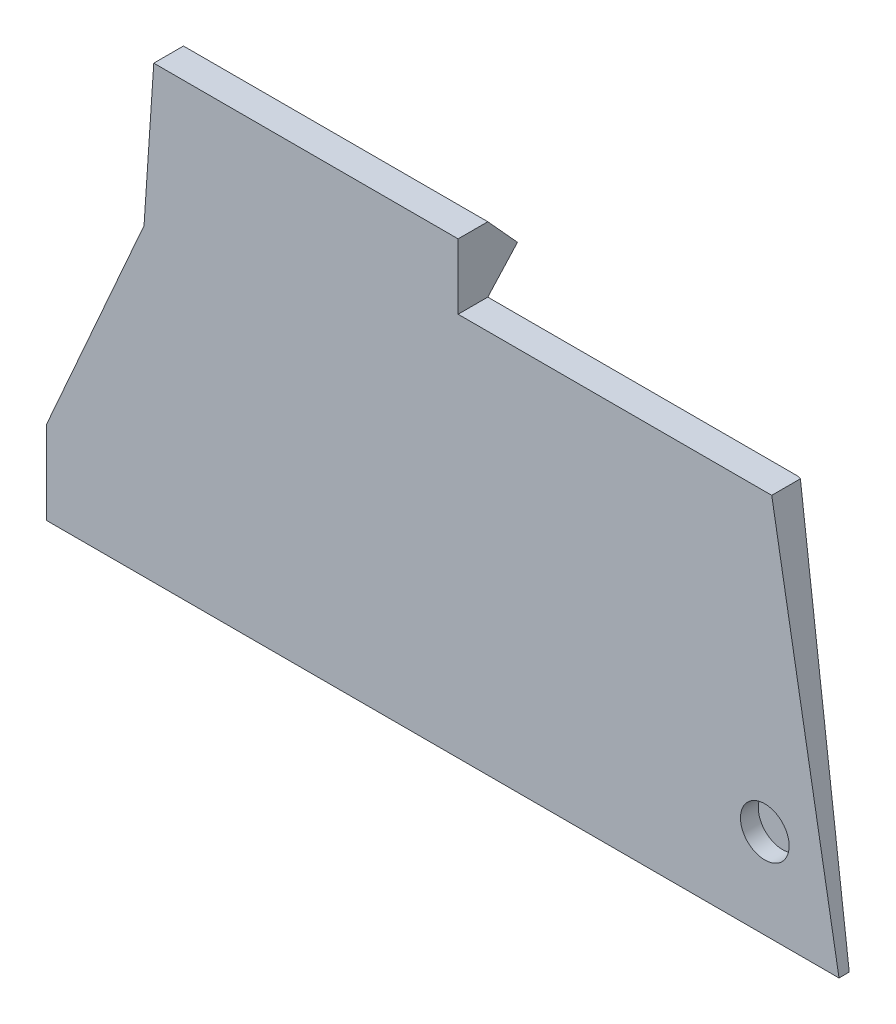
from build123d import *

# Parameters (mm, degrees)
BOSS_EXTRU_1_DEPTH      = 75.755
ENL_V_MAT_EXTRU_1_DEPTH = 124.743757195
ENL_V_MAT_EXTRU_2_DEPTH = 164.948761341
ENL_V_MAT_EXTRU_3_DEPTH = 104.861599502
ESQUISSE7_R             = 4.1
ENL_V_MAT_EXTRU_8_DEPTH = 3


with BuildPart() as part:
    # Esquisse1 → Boss.-Extru.1 (new body)
    with BuildSketch(Plane(origin=(0, 18.275365242, 0), x_dir=(1, 0, 0), z_dir=(0, 1, 0))):
        Polygon((59.971997273, -14.940347022), (23.39332157, -4.940347022), (-35.499575309, -4.940347022), (-79.817340578, -9.940347022), (-79.817340578, -14.940347022), align=None)
    extrude(amount=BOSS_EXTRU_1_DEPTH)

    # Esquisse2 → Enlèv. mat.-Extru.1 (cut, through all)
    with BuildSketch(Plane.XY.offset(14.940347022)):
        Polygon((-79.817340578, 32.378172924), (-63.428173599, 69.489176305), (-61.786327919, 94.030365243), (-79.817340578, 94.030365243), align=None)
        Polygon((-10.515385045, 94.030365243), (-10.515385045, 83.030365243), (42.318963009, 83.030365243), (59.971997273, -17.829066981), (59.971997273, 94.030365243), align=None)
    extrude(amount=-ENL_V_MAT_EXTRU_1_DEPTH, mode=Mode.SUBTRACT)

    # Esquisse3 → Enlèv. mat.-Extru.2 (cut, through all)
    with BuildSketch(Plane.ZY.offset(79.817340578)):
        Polygon((4.940347022, 18.275365242), (9.940347022, 18.275365242), (4.940347022, 26.275365242), align=None)
        Polygon((4.940347022, 42.491079528), (4.940347022, 26.275365242), (9.940347022, 34.383222385), align=None)
        Polygon((4.940347022, 94.030365243), (4.940347022, 88.530365243), (9.940347022, 94.030365243), align=None)
        Polygon((4.940347022, 58.706793814), (4.940347022, 42.491079528), (9.940347022, 50.598936671), align=None)
        Polygon((4.940347022, 74.9225081), (4.940347022, 58.706793814), (9.940347022, 66.814650957), align=None)
        Polygon((4.940347022, 88.530365243), (4.940347022, 74.9225081), (9.940347022, 83.030365243), align=None)
    extrude(amount=-ENL_V_MAT_EXTRU_2_DEPTH, mode=Mode.SUBTRACT)

    # Esquisse4 → Enlèv. mat.-Extru.3 (cut, through all)
    with BuildSketch(Plane(origin=(0, 83.030365243, 0), x_dir=(1, 0, 0), z_dir=(0, 1, 0))):
        Polygon((23.39332157, -4.940347022), (-10.550727062, -4.940347022), (6.421297254, -9.940347022), align=None)
        Polygon((-10.550727062, -4.940347022), (-44.494775695, -4.940347022), (-27.522751379, -9.940347022), align=None)
        Polygon((-79.817340578, -4.940347022), (-61.934802033, -7.92281089), (-44.494775695, -4.940347022), align=None)
    extrude(amount=-ENL_V_MAT_EXTRU_3_DEPTH, mode=Mode.SUBTRACT)

    # Esquisse7 → Enlèv. mat.-Extru.8 (cut)
    with BuildSketch(Plane(origin=(0, 0, 14.940347022), x_dir=(-1, 0, 0), z_dir=(0, 0, -1))):
        with Locations((-41.152659422, 33.343031941)):
            Circle(ESQUISSE7_R)
    extrude(amount=ENL_V_MAT_EXTRU_8_DEPTH, mode=Mode.SUBTRACT)


solid = part.part
